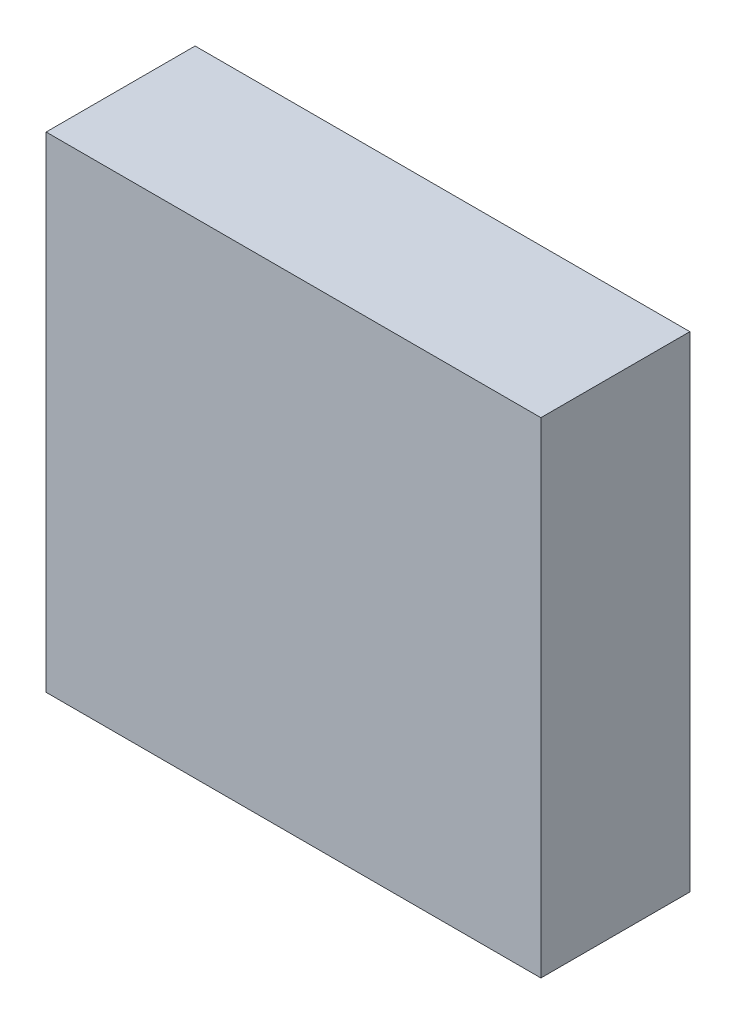
from build123d import *

# Parameters (mm, degrees)
SKETCH1_W               = 3.3212
SKETCH1_H               = 3.2575
COMPONENT_OUTLINE_DEPTH = 1


with BuildPart() as part:
    # Sketch1 → Component_Outline (new body)
    with BuildSketch(Plane.XY):
        with Locations((-0.0971, 0.12875)):
            Rectangle(SKETCH1_W, SKETCH1_H)
    extrude(amount=COMPONENT_OUTLINE_DEPTH)


solid = part.part
